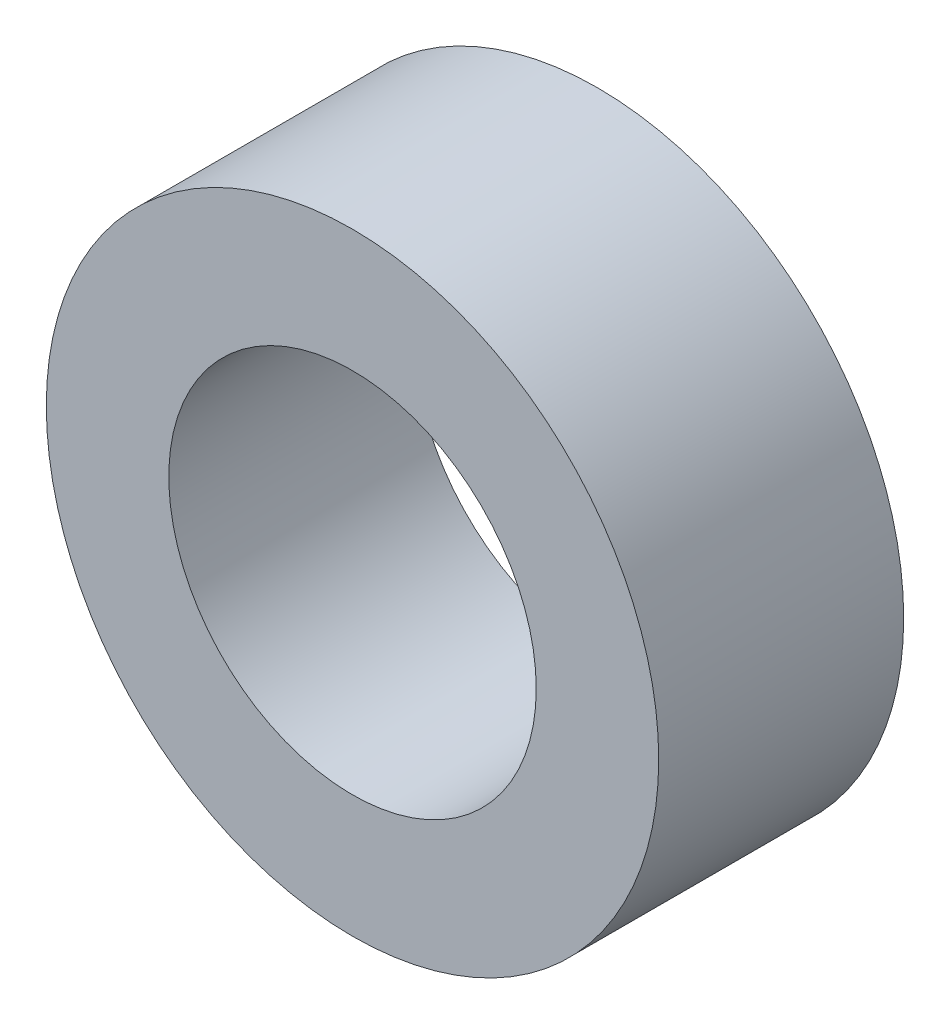
from build123d import *

# Parameters (mm, degrees)
SKETCH1_R           = 3.96875
SKETCH1_R_2         = 2.38125
BOSS_EXTRUDE1_DEPTH = 3.175


with BuildPart() as part:
    # Sketch1 → Boss-Extrude1 (new body)
    with BuildSketch(Plane.XY):
        Circle(SKETCH1_R)
        Circle(SKETCH1_R_2, mode=Mode.SUBTRACT)
    extrude(amount=BOSS_EXTRUDE1_DEPTH)


solid = part.part
